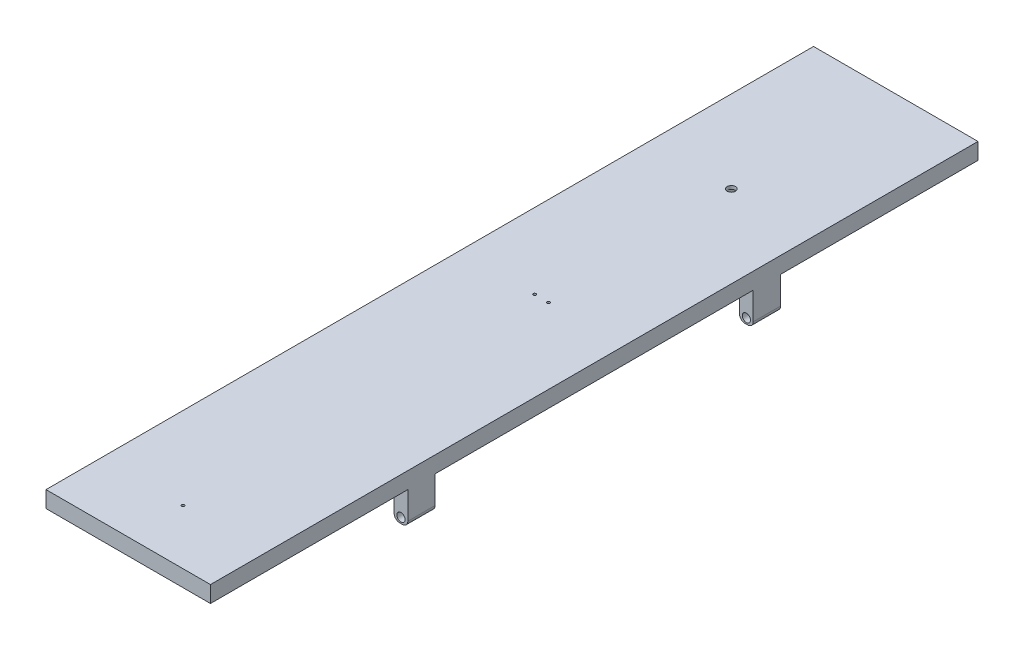
from build123d import *

# Parameters (mm, degrees)
BOSS_EXTRUDE1_DEPTH      = 1100
BOSS_EXTRUDE1_DEPTH_BACK = 300
SKETCH1_R                = 7.5
CUT_EXTRUDE1_DEPTH       = 1142.753038095
CUT_EXTRUDE1_DEPTH_BACK  = 1142.753038095
SKETCH3_W                = 360
SKETCH3_H                = 60
SKETCH4_R                = 7.5
CUT_EXTRUDE2_DEPTH       = 1144.721994193
SKETCH7_W                = 25
SKETCH7_H                = 32
BOSS_EXTRUDE2_DEPTH      = 37.5
SKETCH8_W                = 16
SKETCH8_H                = 32.5
CUT_EXTRUDE4_DEPTH       = 1127.346305538
SKETCH9_W                = 16
SKETCH9_H                = 64
CUT_EXTRUDE5_DEPTH       = 24
SKETCH10_R               = 2.5908
CUT_EXTRUDE6_DEPTH       = 20


with BuildPart() as part:
    # Sketch1 → Boss-Extrude1 (new, two sides: drawn at the far end of the back side and taken through both)
    with BuildSketch(Plane.XY.offset(-BOSS_EXTRUDE1_DEPTH_BACK)):
        with BuildLine():
            Line((0, 0), (0, 30))
            Line((0, 30), (-300, 30))
            Line((-300, 30), (-300, 0))
            Line((-300, 0), (-300, -50))
            ThreePointArc((-300, -50), (-297.071067812, -57.071067812), (-290, -60))
            Line((-290, -60), (-285, -60))
            ThreePointArc((-285, -60), (-277.928932188, -57.071067812), (-275, -50))
            Line((-275, -50), (-275, 0))
            Line((-275, 0), (-25, 0))
            Line((-25, 0), (-25, -50))
            ThreePointArc((-25, -50), (-22.071067812, -57.071067812), (-15, -60))
            Line((-15, -60), (-10, -60))
            ThreePointArc((-10, -60), (-2.928932188, -57.071067812), (0, -50))
            Line((0, -50), (0, 0))
        make_face()
        with Locations((-12.5, -50)):
            Circle(SKETCH1_R, mode=Mode.SUBTRACT)
        with Locations(Location((-287.5, -50, 0), (0, 0, 180))):
            Circle(SKETCH1_R, mode=Mode.SUBTRACT)
    extrude(amount=BOSS_EXTRUDE1_DEPTH + BOSS_EXTRUDE1_DEPTH_BACK)

    # Sketch3 → Cut-Extrude1 (cut, two sides: drawn at the far end of the back side and taken through both)
    with BuildSketch(Plane(origin=(0, 0, 0), x_dir=(0, 0, -1), z_dir=(1, 0, 0)).offset(-CUT_EXTRUDE1_DEPTH_BACK)):
        with Locations((-920, -30)):
            Rectangle(SKETCH3_W, SKETCH3_H)
        Polygon((0, 0), (300, 0), (300, -60), (0, -60), (-60, -60), (-60, 0), align=None)
        Polygon((-690, -60), (-110, -60), (-110, -50), (-110, 0), (-690, 0), (-690, -50), align=None)
    extrude(amount=CUT_EXTRUDE1_DEPTH + CUT_EXTRUDE1_DEPTH_BACK, mode=Mode.SUBTRACT)

    # Sketch4 → Cut-Extrude2 (cut, through all)
    with BuildSketch(Plane(origin=(0, 30, 0), x_dir=(1, 0, 0), z_dir=(0, 1, 0))):
        with Locations(Location((-150, 0, 0), (0, 0, 180))):
            Circle(SKETCH4_R)
    extrude(amount=-CUT_EXTRUDE2_DEPTH, mode=Mode.SUBTRACT)

    # Sketch7 → Boss-Extrude2 (add)
    with BuildSketch(Plane(origin=(0, 0, 0), x_dir=(-1, 0, 0), z_dir=(0, -1, 0))):
        with Locations((150, 0)):
            Rectangle(SKETCH7_W, SKETCH7_H)
    extrude(amount=BOSS_EXTRUDE2_DEPTH)

    # Sketch8 → Cut-Extrude4 (cut, through all)
    with BuildSketch(Plane.XY.offset(16)):
        with Locations((-150, -16.25)):
            Rectangle(SKETCH8_W, SKETCH8_H)
    extrude(amount=-CUT_EXTRUDE4_DEPTH, mode=Mode.SUBTRACT)

    # Sketch9 → Cut-Extrude5 (cut)
    with BuildSketch(Plane.XZ):
        with Locations((-150, 0)):
            Rectangle(SKETCH9_W, SKETCH9_H)
    extrude(amount=-CUT_EXTRUDE5_DEPTH, mode=Mode.SUBTRACT)

    # Sketch10 → Cut-Extrude6 (cut)
    with BuildSketch(Plane(origin=(0, 30, 0), x_dir=(1, 0, 0), z_dir=(0, 1, 0))):
        with Locations(Location((-150, -1000, 0), (0, 0, 180))):
            Circle(SKETCH10_R)
        with Locations(Location((-162.7, -345.95, 0), (0, 0, 180))):
            Circle(SKETCH10_R)
        with Locations(Location((-137.3, -345.95, 0), (0, 0, 180))):
            Circle(SKETCH10_R)
    extrude(amount=-CUT_EXTRUDE6_DEPTH, mode=Mode.SUBTRACT)


solid = part.part
